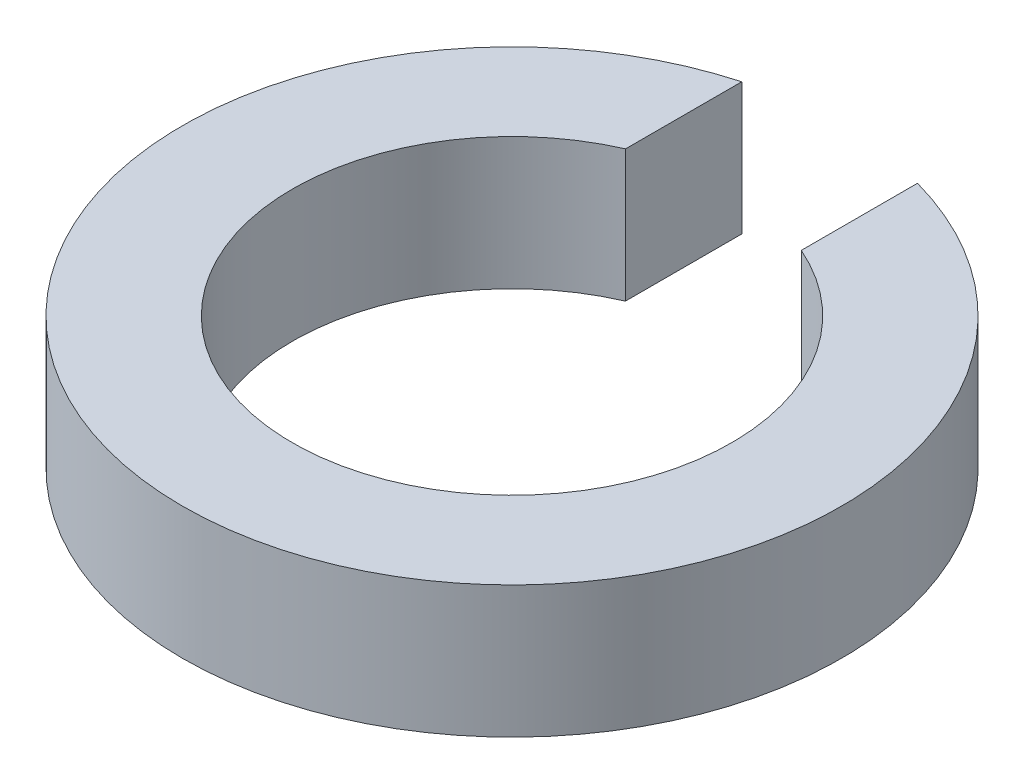
from build123d import *

# Parameters (mm, degrees)
SKETCH1_R           = 7.5
SKETCH1_R_2         = 5
BOSS_EXTRUDE1_DEPTH = 3
SKETCH2_W           = 4
SKETCH2_H           = 4
CUT_EXTRUDE1_DEPTH  = 3.5


with BuildPart() as part:
    # Sketch1 → Boss-Extrude1 (new body)
    with BuildSketch(Plane(origin=(0, 0, 0), x_dir=(1, 0, 0), z_dir=(0, 1, 0))):
        with Locations(Location((0, 0, 0), (0, 0, 270))):
            Circle(SKETCH1_R)
        with Locations(Location((0, 0, 0), (0, 0, 270))):
            Circle(SKETCH1_R_2, mode=Mode.SUBTRACT)
    extrude(amount=BOSS_EXTRUDE1_DEPTH)

    # Sketch2 → Cut-Extrude1 (cut)
    with BuildSketch(Plane(origin=(0, 3, 0), x_dir=(1, 0, 0), z_dir=(0, 1, 0))):
        with Locations((0, 5.942306576)):
            Rectangle(SKETCH2_W, SKETCH2_H)
    extrude(amount=-CUT_EXTRUDE1_DEPTH, mode=Mode.SUBTRACT)


solid = part.part
